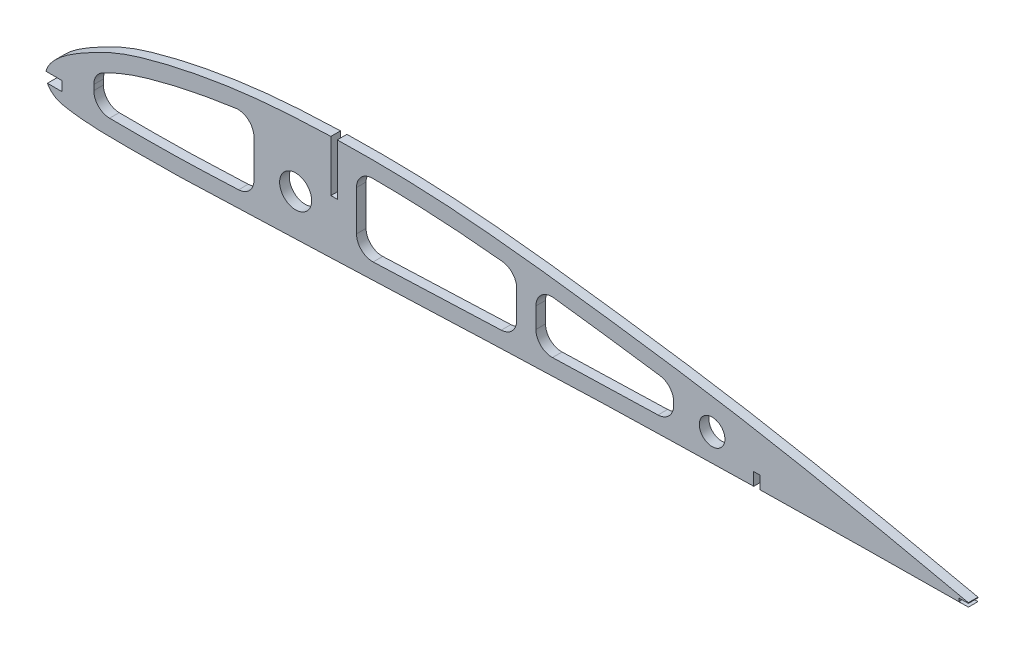
from build123d import *

# Parameters (mm, degrees)
SKETCH_1_R          = 5
SKETCH_1_R_2        = 4
EXTRUDE_1_DEPTH     = 3
CUT_EXTRUDE_2_DEPTH = 291.422386836


with BuildPart() as part:
    # 草图1 → 凸台-拉伸1 (new body)
    with BuildSketch(Plane.XY):
        with BuildLine():
            Line((90, 12.3715), (90, 28.372426217))
            add(Edge.make_bspline(
                [(90, 28.372426217), (89.259446982, 28.350928743), (82.363996343, 28.13322439), (72.403347361, 27.586524792), (60.185862052, 26.226268085), (51.080991088, 24.79810862), (42.033943524, 23.000087944), (34.581994337, 21.174922903), (28.697351661, 19.44563851), (24.361981086, 17.983441115), (20.174828998, 16.207949367), (16.078941989, 14.139912989), (12.040296713, 11.946766626), (8.14011433, 9.56039573), (5.153679337, 7.316395724), (3.100060439, 5.200618052), (1.813825976, 3.470730924), (1.237398467, 2.180506339), (1.085380705, 1.529058937), (1.078882286, 1.5)],
                knots=[0.345773533, 0.345773533, 0.345773533, 0.345773533, 0.349398211, 0.379527288, 0.394591827, 0.409656366, 0.424720905, 0.439785444, 0.447317713, 0.454849983, 0.462382252, 0.469914522, 0.477446791, 0.484979061, 0.49251133, 0.496277465, 0.5000436, 0.503809734, 0.503985678, 0.503985678, 0.503985678, 0.503985678], degree=3))
            Line((1.078882286, 1.5), (6, 1.5))
            Line((6, 1.5), (6, -1.5))
            Line((6, -1.5), (1.522379628, -1.5))
            add(Edge.make_bspline(
                [(1.522379628, -1.5), (1.617903461, -1.678770523), (2.068186491, -2.42442122), (3.143139608, -3.601090845), (4.854253, -4.619355756), (6.927567017, -5.105597911), (9.209034621, -5.454839075), (12.219971865, -5.84289763), (16.020132359, -6.14266222), (20.609524976, -6.2611368), (25.231457517, -6.286948592), (31.397380169, -6.280305851), (39.107274969, -6.240736398), (48.336813051, -6.022096429), (57.579935967, -5.612990736), (66.840654471, -5.242934226), (76.096556555, -4.921715721), (88.435998513, -4.515955408), (103.853120896, -3.973102953), (122.354625015, -3.248110744), (140.857835973, -2.495489966), (159.368527813, -1.804089638), (177.884173919, -1.222493213), (196.4033921, -0.774877257), (211.106034353, -0.46143934), (219.638958118, -0.28014938), (222, -0.231405833)],
                knots=[0.510182255, 0.510182255, 0.510182255, 0.510182255, 0.511342004, 0.515108139, 0.518874273, 0.522640408, 0.526406543, 0.530172677, 0.537704947, 0.545237216, 0.552769486, 0.560301755, 0.575366294, 0.590430833, 0.605495372, 0.620559911, 0.63562445, 0.650688989, 0.680818067, 0.710947144, 0.741076222, 0.7712053, 0.801334378, 0.831463456, 0.861592533, 0.873117312, 0.873117312, 0.873117312, 0.873117312], degree=3))
            Line((222, -0.231405833), (222, 3.768284765))
            Line((222, 3.768284765), (224, 3.768284765))
            Line((224, 3.768284765), (224, -0.190486213))
            add(Edge.make_bspline(
                [(224, -0.190486213), (227.14486696, -0.126773539), (236.463303784, 0.052517956), (251.961175933, 0.256656825), (270.471854229, 0.429163033), (282.824771355, 0.587434741), (289, 0.610062865)],
                knots=[0.8763714, 0.8763714, 0.8763714, 0.8763714, 0.891721611, 0.921850689, 0.951979767, 0.982108845, 0.982108845, 0.982108845, 0.982108845], degree=3))
            Line((289, 0.610062865), (286, 0.610062865))
            Line((286, 0.610062865), (286, 1.610062865))
            Line((286, 1.610062865), (289, 1.610062865))
            Line((289, 1.610062865), (289, 1.816246039))
            add(Edge.make_bspline(
                [(289, 1.816246039), (276.957314444, 4.502285023), (258.861554155, 8.397620333), (234.648247971, 13.152786595), (216.448478593, 16.478914183), (198.182873559, 19.371550405), (179.850571346, 21.924148488), (161.503162682, 24.358614825), (143.127892269, 26.473190985), (124.712239059, 28.043780086), (107.661076739, 28.627794226), (96.749283398, 28.541845307), (92, 28.425883181)],
                knots=[0.017978355, 0.017978355, 0.017978355, 0.017978355, 0.07823651, 0.108365588, 0.138494666, 0.168623744, 0.198752821, 0.228881899, 0.259010977, 0.289140055, 0.319269133, 0.342510787, 0.342510787, 0.342510787, 0.342510787], degree=3))
            Line((92, 28.425883181), (92, 12.3715))
            Line((92, 12.3715), (90, 12.3715))
        make_face()
        with Locations((79, 8)):
            Circle(SKETCH_1_R, mode=Mode.SUBTRACT)
        with Locations((209, 8)):
            Circle(SKETCH_1_R_2, mode=Mode.SUBTRACT)
    extrude(amount=EXTRUDE_1_DEPTH)

    # 草图3 → 切除-拉伸2 (cut, through all)
    with BuildSketch(Plane.XY):
        with BuildLine():
            Line((16, 5.402967421), (16, 3.749572283))
            ThreePointArc((16, 3.749572283), (17.43862744, 0.240067263), (20.926650195, -1.249889668))
            add(Edge.make_bspline(
                [(20.926650195, -1.249889668), (21.774172276, -1.262324122), (22.628944162, -1.270076322), (24.631357544, -1.281688823), (25.78455057, -1.283642157), (29.246278981, -1.283863887), (31.564498991, -1.277624199), (36.178821914, -1.249716978), (38.477208261, -1.225805817), (43.065916773, -1.143353772), (45.357830447, -1.085798853), (49.942071524, -0.935363079), (52.243600435, -0.841029597), (56.765262425, -0.649905427), (58.983967723, -0.555595534), (61.201389306, -0.466209999)],
                knots=[0.097664849, 0.097664849, 0.097664849, 0.097664849, 0.109375, 0.109375, 0.125, 0.125, 0.15625, 0.15625, 0.1875, 0.1875, 0.21875, 0.21875, 0.25, 0.25, 0.279748342, 0.279748342, 0.279748342, 0.279748342], degree=3))
            ThreePointArc((61.201389306, -0.466209999), (64.606032897, 1.066132334), (65.999999998, 4.529732589))
            Line((65.999999998, 4.529732589), (65.999999998, 16.175207171))
            ThreePointArc((65.999999998, 16.175207171), (64.287676461, 19.942325894), (60.323526607, 21.129234195))
            add(Edge.make_bspline(
                [(60.323526607, 21.129234195), (59.14328274, 20.968071656), (57.964431767, 20.796736398), (53.109249428, 20.046773379), (49.445857595, 19.384253181), (42.158673028, 17.868714577), (38.533379611, 17.019586343), (33.148990447, 15.546220745), (31.362942012, 15.022439399), (27.821005995, 13.880218625), (26.067238608, 13.253271835), (22.635818059, 11.812670552), (20.957942753, 11.004847704), (19.099592195, 10.049689097), (18.896441621, 9.944700093), (18.693547477, 9.839213217)],
                knots=[0.029920383, 0.029920383, 0.029920383, 0.029920383, 0.033494004, 0.033494004, 0.044658672, 0.044658672, 0.05582334, 0.05582334, 0.061405674, 0.061405674, 0.066988008, 0.066988008, 0.072570342, 0.072570342, 0.073256353, 0.073256353, 0.073256353, 0.073256353], degree=3))
            ThreePointArc((18.693547477, 9.839213217), (16.726110517, 7.997937304), (16, 5.402967421))
        make_face()
        with BuildLine():
            Line((98, 18.550079988), (98, 6.014495108))
            ThreePointArc((98, 6.014495108), (99.530624101, 2.414018629), (103.18537235, 1.01793258))
            add(Edge.make_bspline(
                [(103.18537235, 1.01793258), (105.560867454, 1.106063391), (107.936437779, 1.195881883), (119.590927656, 1.6441911), (128.873439493, 2.026235766), (139.842898274, 2.458620096), (141.517508234, 2.523944638), (143.192405577, 2.588444329)],
                knots=[0.467989967, 0.467989967, 0.467989967, 0.467989967, 0.5, 0.5, 0.625, 0.625, 0.647515554, 0.647515554, 0.647515554, 0.647515554], degree=3))
            ThreePointArc((143.192405577, 2.588444329), (146.602917421, 4.117900034), (148, 7.584740967))
            Line((148, 7.584740967), (148, 16.344040065))
            ThreePointArc((148, 16.344040065), (146.709868743, 19.696184738), (143.505250436, 21.318446763))
            add(Edge.make_bspline(
                [(143.505250436, 21.318446763), (142.733269268, 21.396856882), (141.961371617, 21.473825477), (137.095631637, 21.949495859), (133.006687672, 22.305846232), (124.838758232, 22.891937538), (120.76027081, 23.118394336), (112.589349819, 23.431909041), (108.50024347, 23.520641418), (103.942207816, 23.54715361), (103.476725809, 23.549024612), (103.011200556, 23.550067443)],
                knots=[0.738217106, 0.738217106, 0.738217106, 0.738217106, 0.75, 0.75, 0.8125, 0.8125, 0.875, 0.875, 0.9375, 0.9375, 0.944607852, 0.944607852, 0.944607852, 0.944607852], degree=3))
            ThreePointArc((103.011200556, 23.550067443), (99.468428309, 22.089571673), (98, 18.550079988))
        make_face()
        with BuildLine():
            Line((154, 14.537684078), (154, 8.170617563))
            ThreePointArc((154, 8.170617563), (155.525809704, 4.574786396), (159.172000715, 3.173576864))
            add(Edge.make_bspline(
                [(159.172000715, 3.173576864), (161.473677828, 3.252801775), (163.775686209, 3.329549926), (170.732455506, 3.552774746), (175.388689917, 3.690754395), (184.07020031, 3.924521784), (188.094738333, 4.024115619), (192.117455336, 4.118639618)],
                knots=[0.71908585, 0.71908585, 0.71908585, 0.71908585, 0.75, 0.75, 0.8125, 0.8125, 0.866546799, 0.866546799, 0.866546799, 0.866546799], degree=3))
            ThreePointArc((192.117455336, 4.118639618), (195.576819584, 5.623499462), (197, 9.117259852))
            Line((197, 9.117259852), (197, 10.112022474))
            ThreePointArc((197, 10.112022474), (195.77958016, 13.385365385), (192.714090476, 15.060767244))
            add(Edge.make_bspline(
                [(192.714090476, 15.060767244), (191.944613201, 15.171800732), (191.174825659, 15.282099728), (186.308954619, 15.974755997), (182.203786583, 16.539615577), (173.988030512, 17.653320176), (169.883033971, 18.199812389), (163.72254432, 18.989569369), (161.665308348, 19.2482867), (159.608604404, 19.500505924)],
                knots=[0.488248297, 0.488248297, 0.488248297, 0.488248297, 0.5, 0.5, 0.5625, 0.5625, 0.625, 0.625, 0.656347088, 0.656347088, 0.656347088, 0.656347088], degree=3))
            ThreePointArc((159.608604404, 19.500505924), (155.686619703, 18.282214891), (154, 14.537684078))
        make_face()
    extrude(amount=CUT_EXTRUDE_2_DEPTH, mode=Mode.SUBTRACT)


solid = part.part
